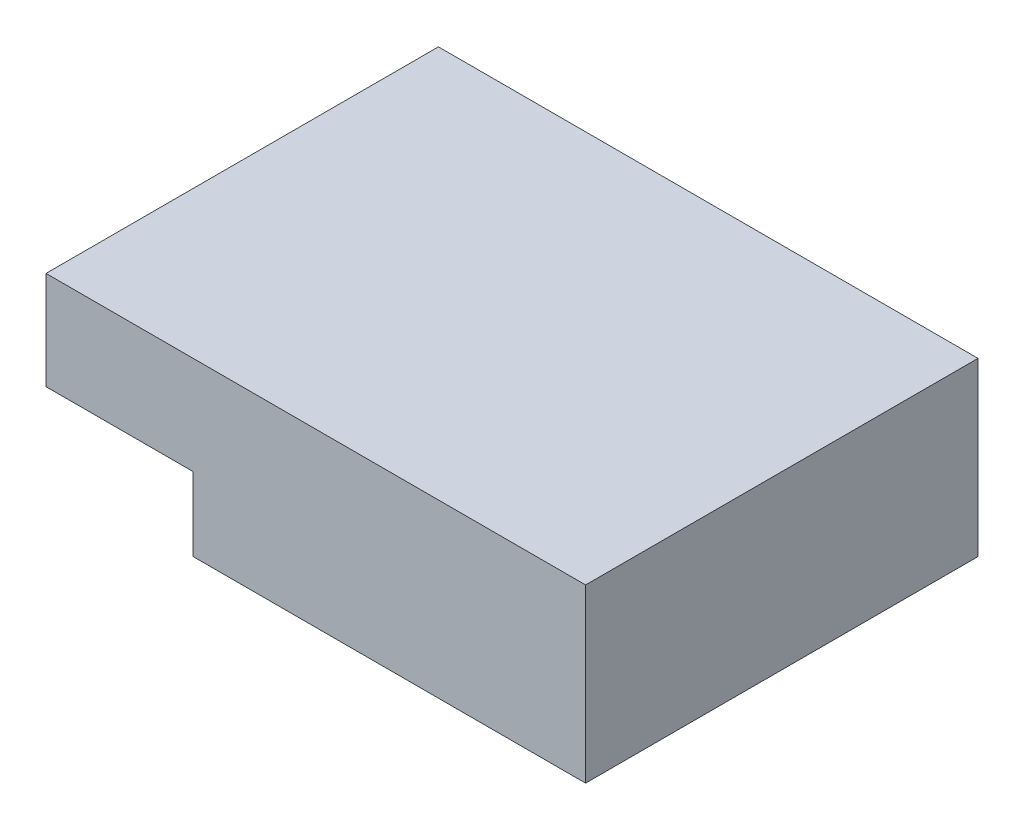
from build123d import *

# Parameters (mm, degrees)
BOSS_EXTRUDE1_DEPTH = 4


with BuildPart() as part:
    # Sketch1 → Boss-Extrude1 (new, symmetric)
    with BuildSketch(Plane.XY):
        Polygon((0, 0), (0, 1.5), (-3, 1.5), (-3, 3.5), (8, 3.5), (8, 0), align=None)
    extrude(amount=BOSS_EXTRUDE1_DEPTH, both=True)


solid = part.part
